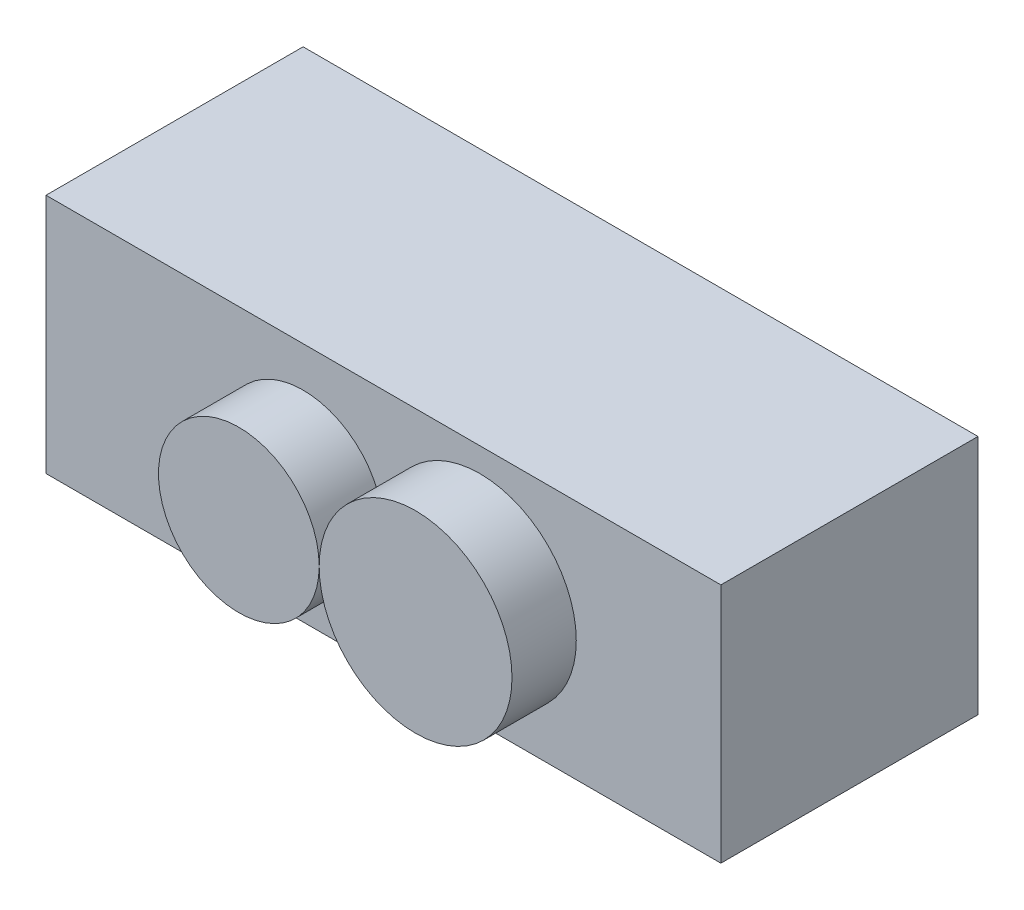
from build123d import *

# Parameters (mm, degrees)
SKETCH3_W             = 42
SKETCH3_H             = 15
BOSS_EXTRUDE1_DEPTH   = 16
SKETCH4_R             = 5
BOSS_EXTRUDE4_DEPTH   = 4
SKETCH4_R_2           = 6
BOSS_EXTRUDE4_2_DEPTH = 4


with BuildPart() as part:
    # Sketch3 → Boss-Extrude1 (new body)
    with BuildSketch(Plane.XY):
        Rectangle(SKETCH3_W, SKETCH3_H)
    extrude(amount=BOSS_EXTRUDE1_DEPTH)


with BuildPart() as body_2:
    # Sketch4 → Boss-Extrude4 (new body)
    with BuildSketch(Plane.XY.offset(16)):
        with Locations((-5, 0)):
            Circle(SKETCH4_R)
    extrude(amount=BOSS_EXTRUDE4_DEPTH)


with BuildPart() as body_3:
    # Sketch4 → Boss-Extrude4 2 (new body)
    with BuildSketch(Plane.XY.offset(16)):
        with Locations((6, 0)):
            Circle(SKETCH4_R_2)
    extrude(amount=BOSS_EXTRUDE4_2_DEPTH)


solid = Compound([part.part, body_2.part, body_3.part])
